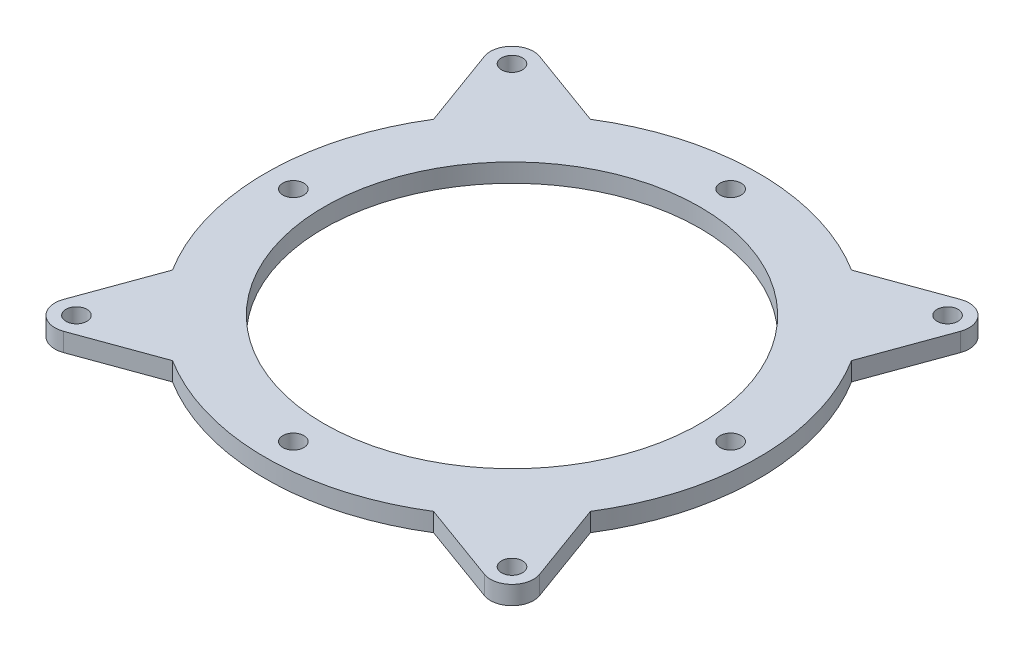
from build123d import *

# Parameters (mm, degrees)
SKETCH_1_R      = 30.5
SKETCH_1_R_2    = 1.7
EXTRUDE_1_DEPTH = 3


with BuildPart() as part:
    # 草图1 → 凸台-拉伸1 (new body)
    with BuildSketch(Plane(origin=(0, 0, 0), x_dir=(1, 0, 0), z_dir=(0, 1, 0))):
        with BuildLine():
            Line((34.158268558, 38.644263232), (21.19197667, 33.924918936))
            ThreePointArc((21.19197667, 33.924918936), (0, 40), (-21.19197667, 33.924918936))
            Line((-21.19197667, 33.924918936), (-34.158268558, 38.644263232))
            ThreePointArc((-34.158268558, 38.644263232), (-37.830212793, 37.830212793), (-38.644263232, 34.158268558))
            Line((-38.644263232, 34.158268558), (-33.924918936, 21.19197667))
            ThreePointArc((-33.924918936, 21.19197667), (-40, 0), (-33.924918936, -21.19197667))
            Line((-33.924918936, -21.19197667), (-38.644263232, -34.158268558))
            ThreePointArc((-38.644263232, -34.158268558), (-37.830212793, -37.830212793), (-34.158268558, -38.644263232))
            Line((-34.158268558, -38.644263232), (-21.19197667, -33.924918936))
            ThreePointArc((-21.19197667, -33.924918936), (0, -40), (21.19197667, -33.924918936))
            Line((21.19197667, -33.924918936), (34.158268558, -38.644263232))
            ThreePointArc((34.158268558, -38.644263232), (37.830212793, -37.830212793), (38.644263232, -34.158268558))
            Line((38.644263232, -34.158268558), (33.924918936, -21.19197667))
            ThreePointArc((33.924918936, -21.19197667), (40, 0), (33.924918936, 21.19197667))
            Line((33.924918936, 21.19197667), (38.644263232, 34.158268558))
            ThreePointArc((38.644263232, 34.158268558), (37.830212793, 37.830212793), (34.158268558, 38.644263232))
        make_face()
        with Locations(Location((0, 0, 0), (0, 0, 270))):
            Circle(SKETCH_1_R, mode=Mode.SUBTRACT)
        with Locations(Location((0, 35.5, 0), (0, 0, 270))):
            Circle(SKETCH_1_R_2, mode=Mode.SUBTRACT)
        with Locations(Location((35.5, 0, 0), (0, 0, 270))):
            Circle(SKETCH_1_R_2, mode=Mode.SUBTRACT)
        with Locations(Location((0, -35.5, 0), (0, 0, 270))):
            Circle(SKETCH_1_R_2, mode=Mode.SUBTRACT)
        with Locations(Location((-35.5, 0, 0), (0, 0, 270))):
            Circle(SKETCH_1_R_2, mode=Mode.SUBTRACT)
        with Locations(Location((35.355339059, 35.355339059, 0), (0, 0, 270))):
            Circle(SKETCH_1_R_2, mode=Mode.SUBTRACT)
        with Locations(Location((35.355339059, -35.355339059, 0), (0, 0, 270))):
            Circle(SKETCH_1_R_2, mode=Mode.SUBTRACT)
        with Locations(Location((-35.355339059, -35.355339059, 0), (0, 0, 270))):
            Circle(SKETCH_1_R_2, mode=Mode.SUBTRACT)
        with Locations(Location((-35.355339059, 35.355339059, 0), (0, 0, 270))):
            Circle(SKETCH_1_R_2, mode=Mode.SUBTRACT)
    extrude(amount=EXTRUDE_1_DEPTH)


solid = part.part
